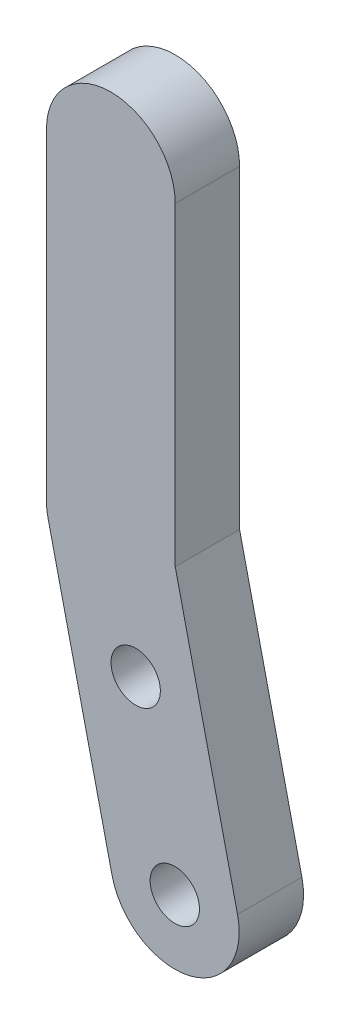
from build123d import *

# Parameters (mm, degrees)
SKETCH1_R           = 1.15
BOSS_EXTRUDE1_DEPTH = 3


with BuildPart() as part:
    # Sketch1 → Boss-Extrude1 (new body)
    with BuildSketch(Plane.XY):
        with BuildLine():
            Line((-2.923110194, -0.674853163), (-5.903711664, 12.235550195))
            ThreePointArc((-5.903711664, 12.235550195), (-5.961317037, 12.570793717), (-5.98060147, 12.910403358))
            Line((-5.98060147, 12.910403358), (-5.98060147, 27.910403358))
            ThreePointArc((-5.98060147, 27.910403358), (-2.98060147, 30.910403358), (0.01939853, 27.910403358))
            Line((0.01939853, 27.910403358), (0.01939853, 13.252210183))
            Line((0.01939853, 13.252210183), (2.923110194, 0.674853163))
            ThreePointArc((2.923110194, 0.674853163), (0.674853163, -2.923110194), (-2.923110194, -0.674853163))
        make_face()
        Circle(SKETCH1_R, mode=Mode.SUBTRACT)
        with Locations((-1.82210354, 7.892397525)):
            Circle(SKETCH1_R, mode=Mode.SUBTRACT)
    extrude(amount=BOSS_EXTRUDE1_DEPTH)


solid = part.part
